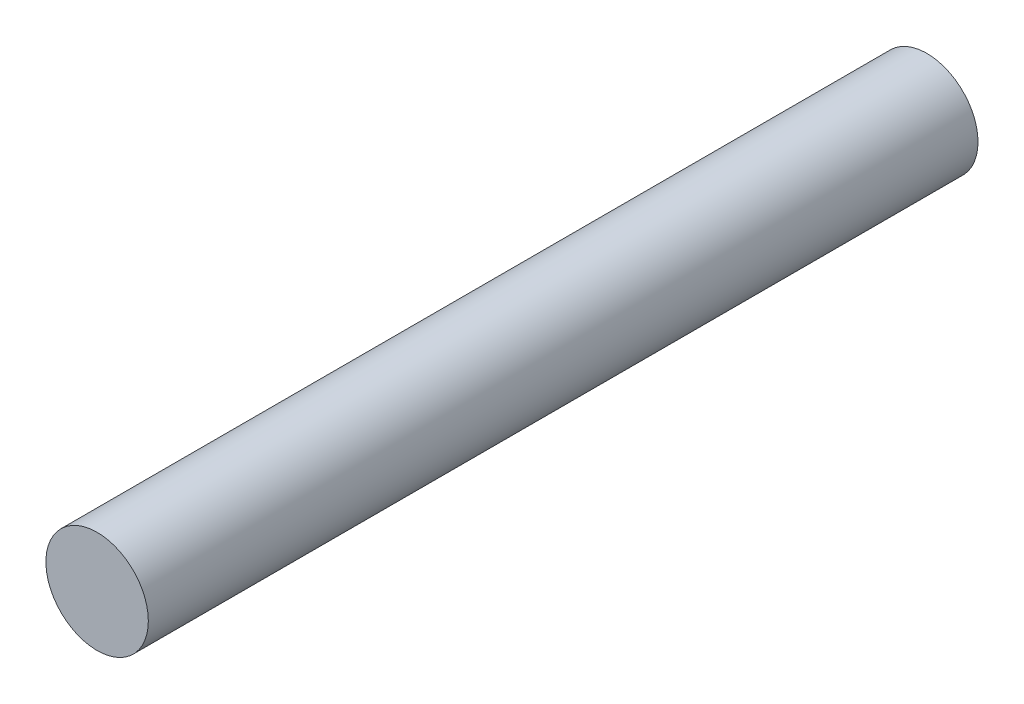
from build123d import *

# Parameters (mm, degrees)
SKETCH_1_R      = 1
EXTRUDE_2_DEPTH = 16.2


with BuildPart() as part:
    # 草图1 → 凸台-拉伸2 (new body)
    with BuildSketch(Plane.XY):
        Circle(SKETCH_1_R)
    extrude(amount=EXTRUDE_2_DEPTH)


solid = part.part
